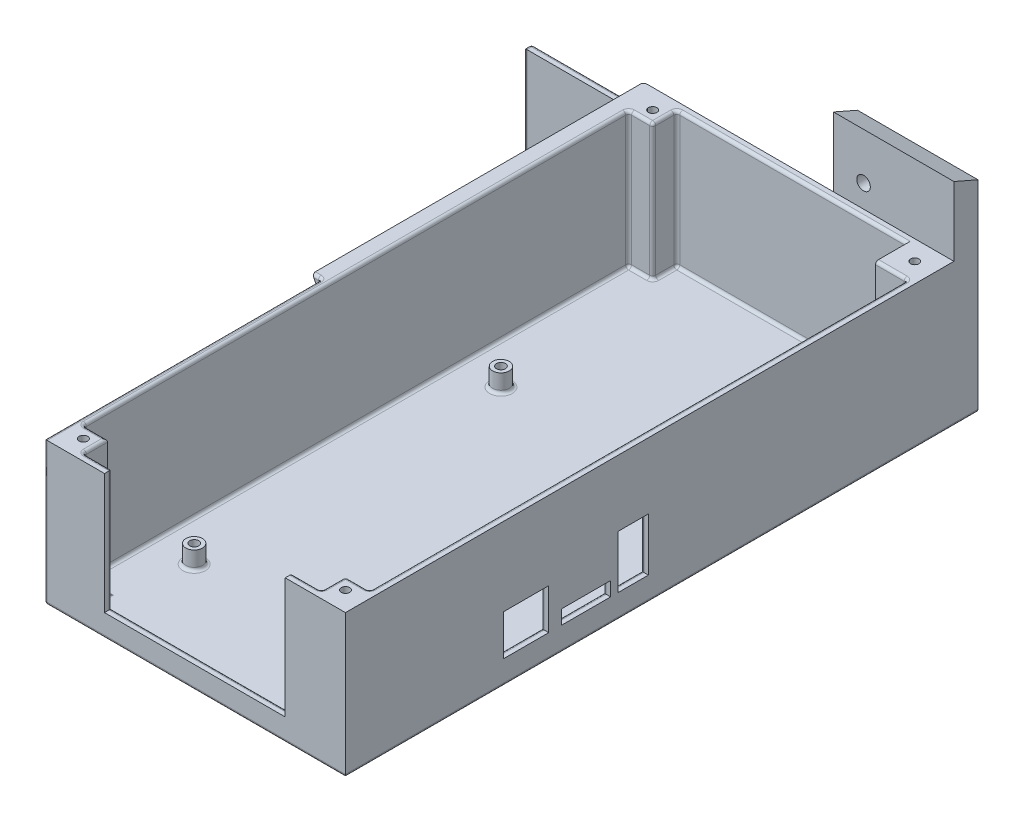
from build123d import *

# Parameters (mm, degrees)
BOSS_EXTRUDE1_DEPTH = 47.5
CUT_EXTRUDE1_START  = 2.5
CUT_EXTRUDE1_DEPTH  = 45
SKETCH5_R           = 1.4
CUT_EXTRUDE2_DEPTH  = 10
SKETCH6_W           = 60
SKETCH6_H           = 40
CUT_EXTRUDE3_DEPTH  = 10
SKETCH7_R           = 2.25
CUT_EXTRUDE4_DEPTH  = 10
SKETCH8_R           = 2.75
SKETCH8_R_2         = 1.5
BOSS_EXTRUDE3_DEPTH = 6
SKETCH9_W           = 40
SKETCH9_H           = 8
BOSS_EXTRUDE4_DEPTH = 15
SKETCH10_R          = 2.25
CUT_EXTRUDE5_DEPTH  = 8
SKETCH11_W          = 15
SKETCH11_H          = 13.5
SKETCH11_W_2        = 10
SKETCH11_H_2        = 17.6
SKETCH11_W_3        = 16.3
SKETCH11_H_3        = 4.7
CUT_EXTRUDE6_DEPTH  = 8
BOSS_EXTRUDE5_START = -80
BOSS_EXTRUDE5_DEPTH = 50
SKETCH15_W          = 40.25
SKETCH15_H          = 7.5
CUT_EXTRUDE7_DEPTH  = 10
BOSS_EXTRUDE6_DEPTH = 110
BOSS_EXTRUDE7_DEPTH = 40
FILLET1_R           = 1


with BuildPart() as part:
    # Sketch1 → Boss-Extrude1 (new body)
    with BuildSketch(Plane(origin=(0, 0, 0), x_dir=(1, 0, 0), z_dir=(0, 1, 0))):
        Polygon((0, 0), (100, 0), (100, 202), (100, 210), (60, 210), (60, 202), (-40.25, 202), (-40.25, 199.5), (0, 199.5), align=None)
    extrude(amount=BOSS_EXTRUDE1_DEPTH)

    # Sketch2 → Cut-Extrude1 (cut)
    with BuildSketch(Plane(origin=(0, 0, 0), x_dir=(1, 0, 0), z_dir=(0, 1, 0)).offset(CUT_EXTRUDE1_START)):
        Polygon((2.5, 10.5), (10.5, 10.5), (10.5, 2.5), (89.5, 2.5), (89.5, 10.5), (97.5, 10.5), (97.5, 189), (87, 189), (87, 199.5), (10.5, 199.5), (10.5, 191.5), (2.5, 191.5), align=None)
    extrude(amount=CUT_EXTRUDE1_DEPTH, mode=Mode.SUBTRACT)

    # Sketch5 → Cut-Extrude2 (cut)
    with BuildSketch(Plane(origin=(0, 47.5, 0), x_dir=(1, 0, 0), z_dir=(0, 1, 0))):
        with Locations(Location((93.5, 195.5, 0), (0, 0, 270))):
            Circle(SKETCH5_R)
        with Locations(Location((93.5, 6.5, 0), (0, 0, 270))):
            Circle(SKETCH5_R)
        with Locations(Location((6.5, 6.5, 0), (0, 0, 270))):
            Circle(SKETCH5_R)
        with Locations(Location((6.5, 195.5, 0), (0, 0, 270))):
            Circle(SKETCH5_R)
    extrude(amount=-CUT_EXTRUDE2_DEPTH, mode=Mode.SUBTRACT)

    # Sketch6 → Cut-Extrude3 (cut)
    with BuildSketch(Plane.XY):
        with Locations((50, 27.5)):
            Rectangle(SKETCH6_W, SKETCH6_H)
    extrude(amount=-CUT_EXTRUDE3_DEPTH, mode=Mode.SUBTRACT)

    # Sketch7 → Cut-Extrude4 (cut)
    with BuildSketch(Plane.XY.offset(-199.5)):
        with Locations((-30.25, 10.5)):
            Circle(SKETCH7_R)
        with Locations((-10.25, 30)):
            Circle(SKETCH7_R)
    extrude(amount=-CUT_EXTRUDE4_DEPTH, mode=Mode.SUBTRACT)

    # Sketch8 → Boss-Extrude3 (add)
    # profile 1 of 4: a face of its own
    with BuildSketch(Plane(origin=(0, 2.5, 0), x_dir=(1, 0, 0), z_dir=(0, 1, 0))):
        with Locations(Location((15.95, 135.67374345, 0), (0, 0, 270))):
            Circle(SKETCH8_R)
        with Locations(Location((15.95, 135.67374345, 0), (0, 0, 270))):
            Circle(SKETCH8_R_2, mode=Mode.SUBTRACT)
    # profile 2 of 4: a face of its own
    with BuildSketch(Plane(origin=(0, 2.5, 0), x_dir=(1, 0, 0), z_dir=(0, 1, 0))):
        with Locations(Location((15.95, 33.82374345, 0), (0, 0, 270))):
            Circle(SKETCH8_R)
        with Locations(Location((15.95, 33.82374345, 0), (0, 0, 270))):
            Circle(SKETCH8_R_2, mode=Mode.SUBTRACT)
    # profile 3 of 4: a face of its own
    with BuildSketch(Plane(origin=(0, 2.5, 0), x_dir=(1, 0, 0), z_dir=(0, 1, 0))):
        with Locations(Location((92.25, 135.673743448, 0), (0, 0, 270))):
            Circle(SKETCH8_R)
        with Locations(Location((92.25, 135.673743448, 0), (0, 0, 270))):
            Circle(SKETCH8_R_2, mode=Mode.SUBTRACT)
    # profile 4 of 4: a face of its own
    with BuildSketch(Plane(origin=(0, 2.5, 0), x_dir=(1, 0, 0), z_dir=(0, 1, 0))):
        with Locations(Location((92.25, 33.823743448, 0), (0, 0, 270))):
            Circle(SKETCH8_R)
        with Locations(Location((92.25, 33.823743448, 0), (0, 0, 270))):
            Circle(SKETCH8_R_2, mode=Mode.SUBTRACT)
    extrude(amount=BOSS_EXTRUDE3_DEPTH)

    # Sketch9 → Boss-Extrude4 (add)
    with BuildSketch(Plane(origin=(0, 47.5, 0), x_dir=(1, 0, 0), z_dir=(0, 1, 0))):
        with Locations((80, 206)):
            Rectangle(SKETCH9_W, SKETCH9_H)
    extrude(amount=BOSS_EXTRUDE4_DEPTH)

    # Sketch10 → Cut-Extrude5 (cut)
    with BuildSketch(Plane(origin=(0, 0, -210), x_dir=(-1, 0, 0), z_dir=(0, 0, -1))):
        with Locations((-70, 55)):
            Circle(SKETCH10_R)
        with Locations((-90, 35)):
            Circle(SKETCH10_R)
    extrude(amount=-CUT_EXTRUDE5_DEPTH, mode=Mode.SUBTRACT)

    # Sketch11 → Cut-Extrude6 (cut)
    with BuildSketch(Plane.ZY.offset(-97.5)):
        with Locations((-59.973743448, 14.75)):
            Rectangle(SKETCH11_W, SKETCH11_H)
        with Locations((-95.563743448, 16.8)):
            Rectangle(SKETCH11_W_2, SKETCH11_H_2)
        with Locations((-79.893743448, 10.35)):
            Rectangle(SKETCH11_W_3, SKETCH11_H_3)
    extrude(amount=-CUT_EXTRUDE6_DEPTH, mode=Mode.SUBTRACT)

    # Sketch12 → Boss-Extrude5 (add)
    with BuildSketch(Plane.XY.offset(BOSS_EXTRUDE5_START)):
        Polygon((0, 12.06), (-3.13, 12.06), (-3.13, 14.05), (-5.815307245, 12.255), (-5.815307245, 6.305), (-3.13, 4.51), (-3.13, 6.5), (0, 6.5), align=None)
        Polygon((-3.13, 32.06), (0, 32.06), (0, 26.5), (-3.13, 26.5), (-3.13, 24.51), (-5.815307245, 26.305), (-5.815307245, 32.255), (-3.13, 34.05), align=None)
    extrude(amount=-BOSS_EXTRUDE5_DEPTH)

    # Sketch15 → Cut-Extrude7 (cut)
    with BuildSketch(Plane.XY.offset(-199.5)):
        with Locations((-20.125, 43.75)):
            Rectangle(SKETCH15_W, SKETCH15_H)
    extrude(amount=-CUT_EXTRUDE7_DEPTH, mode=Mode.SUBTRACT)

    # Sketch16 → Boss-Extrude6 (add)
    with BuildSketch(Plane.XY.offset(-202)):
        Polygon((0, 41.5), (-3, 47.5), (0, 47.5), align=None)
    extrude(amount=BOSS_EXTRUDE6_DEPTH)

    # Sketch18 → Boss-Extrude7 (add)
    with BuildSketch(Plane(origin=(100, 0, 0), x_dir=(0, 0, -1), z_dir=(1, 0, 0))):
        Polygon((202, 62.5), (202, 70.45), (210, 66.95), (210, 62.5), align=None)
    extrude(amount=-BOSS_EXTRUDE7_DEPTH)

    # Fillet1
    fillet1_edges = [part.edges().sort_by_distance(p)[0] for p in [
        (9.875, 0, -202),
        (60, 0, -206),
        (15.95, 2.5, -36.57374345),
        (80, 0, -210),
        (100, 0, -105),
        (92.25, 2.5, -36.573743448),
        (92.25, 2.5, -138.423743448),
        (50, 0, 0),
        (0, 0, -99.75),
        (15.95, 2.5, -138.42374345),
        (0, 23.75, 0),
        (97.5, 14.75, -52.473743448),
        (97.5, 21.5, -59.973743448),
        (97.5, 14.75, -67.473743448),
        (97.5, 8, -59.973743448),
        (97.5, 10.35, -71.743743448),
        (97.5, 12.7, -79.893743448),
        (97.5, 10.35, -88.043743448),
        (97.5, 8, -79.893743448),
        (97.5, 16.8, -90.563743448),
        (97.5, 25.6, -95.563743448),
        (97.5, 16.8, -100.563743448),
        (97.5, 8, -95.563743448),
        (0, 9.28, -130),
        (0, 12.06, -105),
        (0, 6.5, -105),
        (0, 9.28, -80),
        (0, 29.28, -130),
        (0, 32.06, -105),
        (0, 26.5, -105),
        (0, 29.28, -80),
        (0, 20, -199.5),
        (-40.25, 20, -199.5),
        (-40.25, 20, -202),
        (-20.125, 40, -202),
        (0, 40, -200.75),
        (-40.25, 40, -200.75),
        (0, 40.75, -202),
        (0, 47.5, -46),
        (0, 41.5, -147),
        (-1.5, 44.5, -202),
        (0, 44.5, -92),
        (-1.5, 47.5, -92),
        (2.5, 2.5, -101),
        (2.5, 25, -191.5),
        (6.5, 2.5, -10.5),
        (2.5, 25, -10.5),
        (10.5, 2.5, -6.5),
        (50, 2.5, -2.5),
        (10.5, 25, -2.5),
        (89.5, 2.5, -6.5),
        (89.5, 25, -2.5),
        (93.5, 2.5, -10.5),
        (89.5, 25, -10.5),
        (97.5, 2.5, -99.75),
        (97.5, 25, -10.5),
        (92.25, 2.5, -189),
        (97.5, 25, -189),
        (87, 2.5, -194.25),
        (48.75, 2.5, -199.5),
        (10.5, 2.5, -195.5),
        (10.5, 25, -199.5),
        (6.5, 2.5, -191.5),
        (10.5, 25, -191.5),
        (2.5, 47.5, -101),
        (6.5, 47.5, -10.5),
        (10.5, 47.5, -6.5),
        (15.25, 47.5, -2.5),
        (89.5, 47.5, -6.5),
        (93.5, 47.5, -10.5),
        (97.5, 47.5, -99.75),
        (92.25, 47.5, -189),
        (48.75, 47.5, -199.5),
        (10.5, 47.5, -195.5),
        (6.5, 47.5, -191.5),
        (84.75, 47.5, -2.5),
        (50, 7.5, -2.5),
        (80, 27.5, -2.5),
        (20, 27.5, -2.5),
        (-20.125, 0, -199.5),
        (-40.25, 0, -200.75),
    ]]
    fillet(fillet1_edges, radius=FILLET1_R)


solid = part.part
